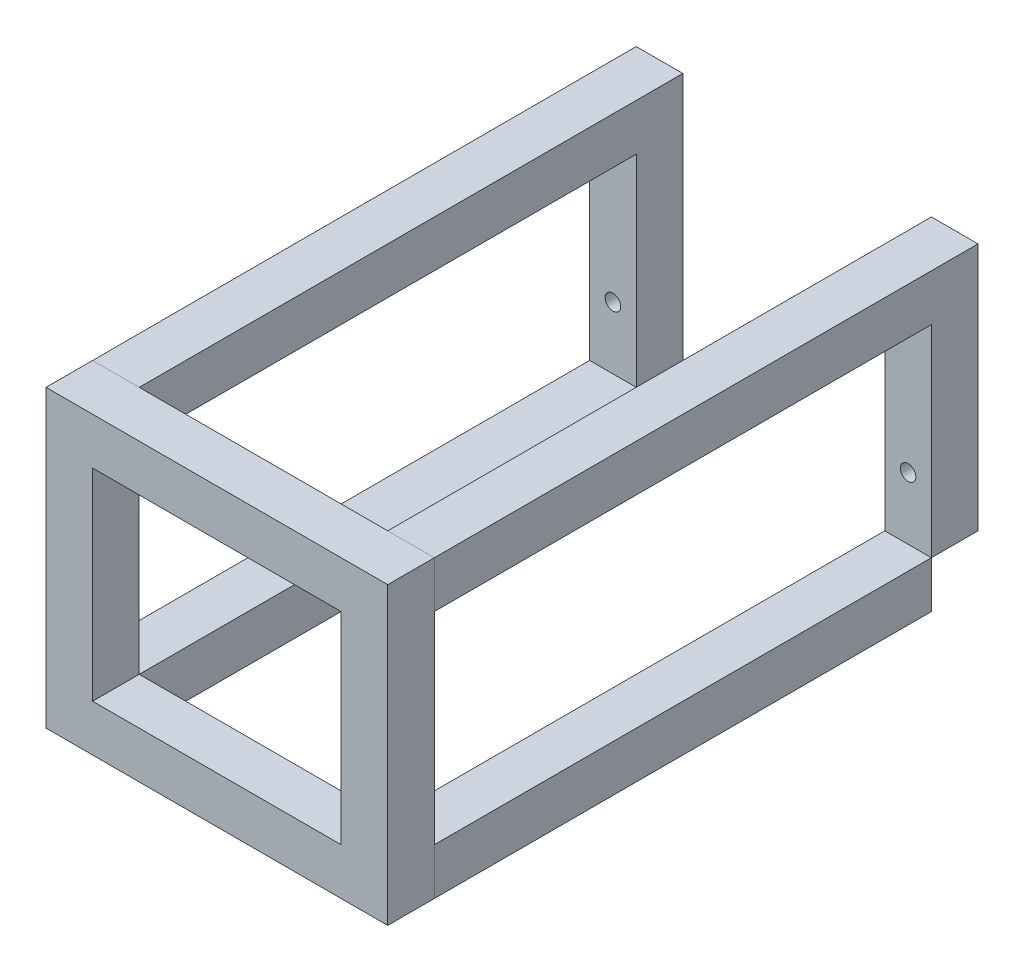
from build123d import *

# Parameters (mm, degrees)
SKETCH2_W             = 19.05
SKETCH2_H             = 101.6
SKETCH2_R             = 3.175
BOSS_EXTRUDE1_DEPTH   = 19.05
BOSS_EXTRUDE1_2_DEPTH = 19.05
SKETCH3_W             = 19.05
SKETCH3_H             = 19.05
BOSS_EXTRUDE2_DEPTH   = 203.2
SKETCH4_W             = 139.7
SKETCH4_H             = 120.65
SKETCH4_W_2           = 101.6
SKETCH4_H_2           = 82.55
BOSS_EXTRUDE6_DEPTH   = 19.05


with BuildPart() as part:
    # Sketch2 → Boss-Extrude1 (new body)
    with BuildSketch(Plane.XY):
        with Locations((-85.985987313, 18.059079762)):
            Rectangle(SKETCH2_W, SKETCH2_H)
        with Locations(Location((-85.985987313, -7.340920238, 0), (0, 0, 180))):
            Circle(SKETCH2_R, mode=Mode.SUBTRACT)
    extrude(amount=BOSS_EXTRUDE1_DEPTH)



with BuildPart() as body_2:
    # Sketch2 → Boss-Extrude1 2 (new body)
    with BuildSketch(Plane.XY):
        with Locations((34.664012687, 18.059079762)):
            Rectangle(SKETCH2_W, SKETCH2_H)
        with Locations(Location((34.664012687, -7.340920238, 0), (0, 0, 180))):
            Circle(SKETCH2_R, mode=Mode.SUBTRACT)
    extrude(amount=BOSS_EXTRUDE1_2_DEPTH)


with BuildPart() as part_1:
    add(part.part)

    add(body_2.part)  # Boss-Extrude2 merges body 2
    # Sketch3 → Boss-Extrude2 (add)
    with BuildSketch(Plane.XY.offset(19.05)):
        with Locations((-85.985987313, 59.334079762)):
            Rectangle(SKETCH3_W, SKETCH3_H)
        with Locations((34.664012687, 59.334079762)):
            Rectangle(SKETCH3_W, SKETCH3_H)
        with Locations((-85.985987313, -42.265920238)):
            Rectangle(SKETCH3_W, SKETCH3_H)
        with Locations((34.664012687, -42.265920238)):
            Rectangle(SKETCH3_W, SKETCH3_H)
    extrude(amount=BOSS_EXTRUDE2_DEPTH)


with BuildPart() as body_2_2:
    # Sketch4 → Boss-Extrude6 (new body)
    with BuildSketch(Plane.XY.offset(222.25)):
        with Locations((-25.660987313, 8.534079762)):
            Rectangle(SKETCH4_W, SKETCH4_H)
        with Locations((-25.660987313, 8.534079762)):
            Rectangle(SKETCH4_W_2, SKETCH4_H_2, mode=Mode.SUBTRACT)
    extrude(amount=BOSS_EXTRUDE6_DEPTH)


solid = Compound([part_1.part, body_2_2.part])
